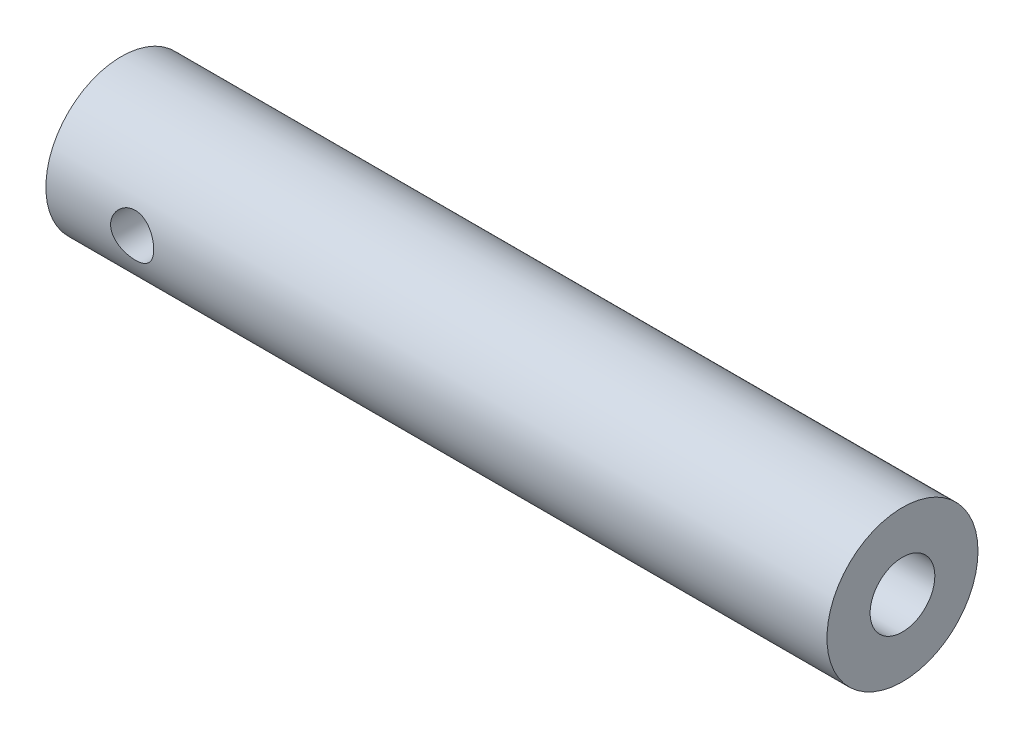
from build123d import *

# Parameters (mm, degrees)
SKETCH2_R           = 17.5
BOSS_EXTRUDE1_DEPTH = 181
SKETCH3_R           = 5
CUT_EXTRUDE1_DEPTH  = 181
SKETCH4_R           = 7.5
CUT_EXTRUDE2_DEPTH  = 20
SKETCH5_R           = 12.5
CUT_EXTRUDE3_DEPTH  = 20


with BuildPart() as part:
    # Sketch2 → Boss-Extrude1 (new body)
    with BuildSketch(Plane(origin=(0, 0, 0), x_dir=(0, 0, -1), z_dir=(1, 0, 0))):
        Circle(SKETCH2_R)
    extrude(amount=BOSS_EXTRUDE1_DEPTH)

    # Sketch3 → Cut-Extrude1 (cut)
    with BuildSketch(Plane.XY.offset(17.5)):
        with Locations((20, 0)):
            Circle(SKETCH3_R)
    extrude(amount=-CUT_EXTRUDE1_DEPTH, mode=Mode.SUBTRACT)

    # Sketch4 → Cut-Extrude2 (cut)
    with BuildSketch(Plane(origin=(181, 0, 0), x_dir=(0, 0, -1), z_dir=(1, 0, 0))):
        Circle(SKETCH4_R)
    extrude(amount=-CUT_EXTRUDE2_DEPTH, mode=Mode.SUBTRACT)

    # Sketch5 → Cut-Extrude3 (cut)
    with BuildSketch(Plane(origin=(161, 0, 0), x_dir=(0, 0, -1), z_dir=(1, 0, 0))):
        Circle(SKETCH5_R)
    extrude(amount=-CUT_EXTRUDE3_DEPTH, mode=Mode.SUBTRACT)


solid = part.part
